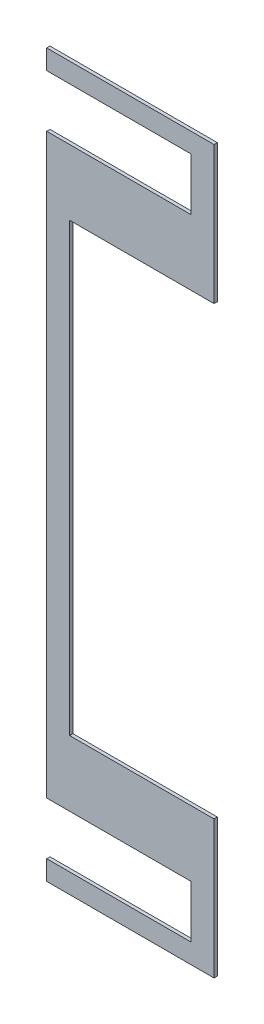
from build123d import *

# Parameters (mm, degrees)
BOSS_EXTRUDE1_DEPTH = 3.175


with BuildPart() as part:
    # Sketch1 → Boss-Extrude1 (new body)
    with BuildSketch(Plane(origin=(0, 0, 0), x_dir=(0, 1, 0), z_dir=(0, 0, 1))):
        Polygon((0, 0), (0, -161.925), (133.35, -161.925), (133.35, -22.225), (565.15, -22.225), (565.15, -161.925), (698.5, -161.925), (698.5, 0), (679.45, 0), (679.45, -139.7), (628.65, -139.7), (628.65, 0), (69.85, 0), (69.85, -139.7), (19.05, -139.7), (19.05, 0), align=None)
    extrude(amount=BOSS_EXTRUDE1_DEPTH)


solid = part.part
